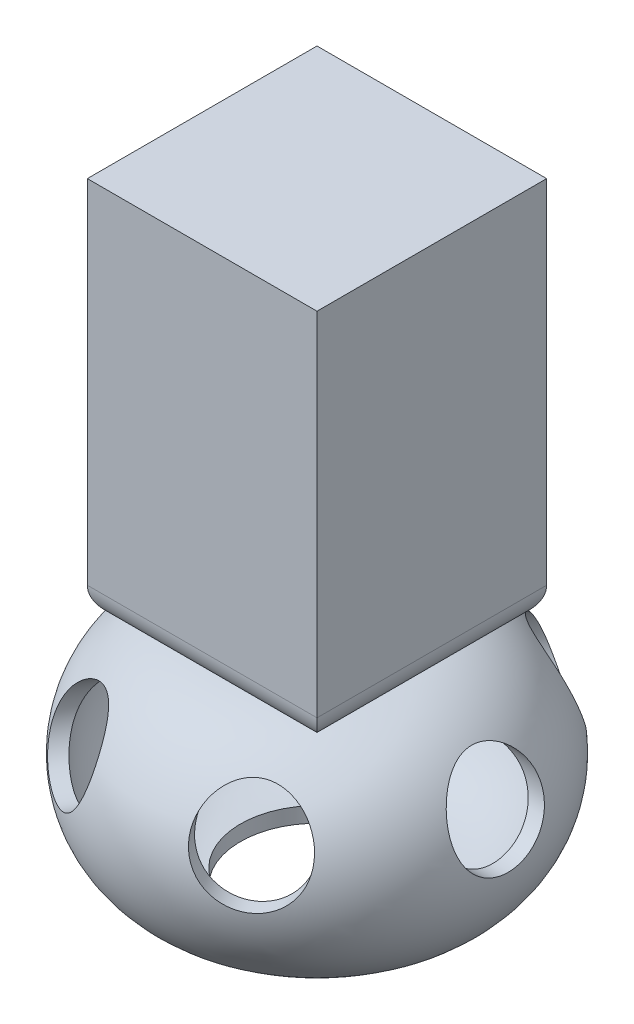
from build123d import *

# Parameters (mm, degrees)
SKETCH3_R           = 1.5
CUT_EXTRUDE1_DEPTH  = 12.592023292
CIRPATTERN1_COUNT   = 6
SKETCH4_W           = 7.5
SKETCH4_H           = 7.5
BOSS_EXTRUDE2_DEPTH = 12.5
FILLET1_R           = 1


with BuildPart() as part:
    # Sketch2 → Revolve1 (revolve)
    with BuildSketch(Plane.XY, mode=Mode.PRIVATE) as revolve1_sk:
        with BuildLine():
            Line((2.5, 7.5), (0, 7.5))
            Line((0, 7.5), (0, 7))
            Line((0, 7), (2.5, 7))
            ThreePointArc((2.5, 7), (5.75, 3.75), (2.5, 0.5))
            Line((2.5, 0.5), (2.5, 0))
            ThreePointArc((2.5, 0), (6.25, 3.75), (2.5, 7.5))
        make_face()
    revolve(revolve1_sk.sketch.rotate(Axis((0, 0, 0), (0, 1, 0)), 90), axis=Axis((0, 0, 0), (0, 1, 0)))

    # Sketch3 → Cut-Extrude1 (cut, symmetric)
    with BuildSketch(Plane(origin=(0, 0, 0), x_dir=(0, 0, -1), z_dir=(1, 0, 0))):
        with Locations(Location((0, 5, 0), (0, 0, 75.140884096))):
            Circle(SKETCH3_R)
    cut_extrude1 = extrude(amount=CUT_EXTRUDE1_DEPTH, both=True, mode=Mode.SUBTRACT)

    # CirPattern1: Cut-Extrude1 ×6 about axis
    cirpattern1_axis = Axis((0, 0, 0), (0, 1, 0))
    for i in range(1, CIRPATTERN1_COUNT):
        add(cut_extrude1.rotate(cirpattern1_axis, i * 360 / CIRPATTERN1_COUNT), mode=Mode.SUBTRACT)

    # Sketch4 → Boss-Extrude2 (add)
    with BuildSketch(Plane(origin=(0, 7.5, 0), x_dir=(1, 0, 0), z_dir=(0, 1, 0))):
        Rectangle(SKETCH4_W, SKETCH4_H)
    extrude(amount=BOSS_EXTRUDE2_DEPTH)

    # Fillet1
    fillet1_edges = [part.edges().sort_by_distance(p)[0] for p in [
        (3.75, 7.5, 0),
        (0, 7.5, -3.75),
        (-3.75, 7.5, 0),
        (0, 7.5, 3.75),
    ]]
    fillet(fillet1_edges, radius=FILLET1_R)


solid = part.part
